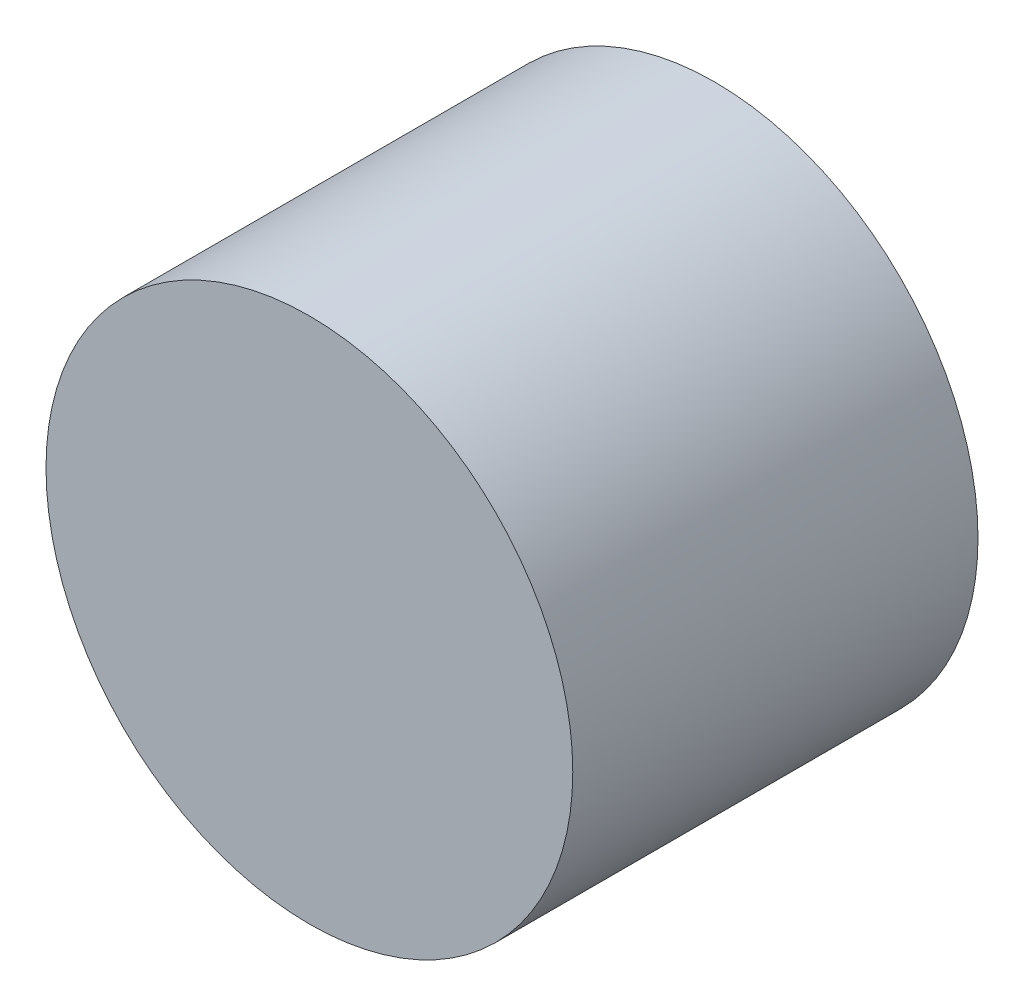
from build123d import *

# Parameters (mm, degrees)
SKETCH_1_R      = 13
EXTRUDE_1_DEPTH = 20


with BuildPart() as part:
    # Эскиз1 → Бобышка-Вытянуть1 (new body)
    with BuildSketch(Plane.XY):
        Circle(SKETCH_1_R)
    extrude(amount=EXTRUDE_1_DEPTH)


solid = part.part
